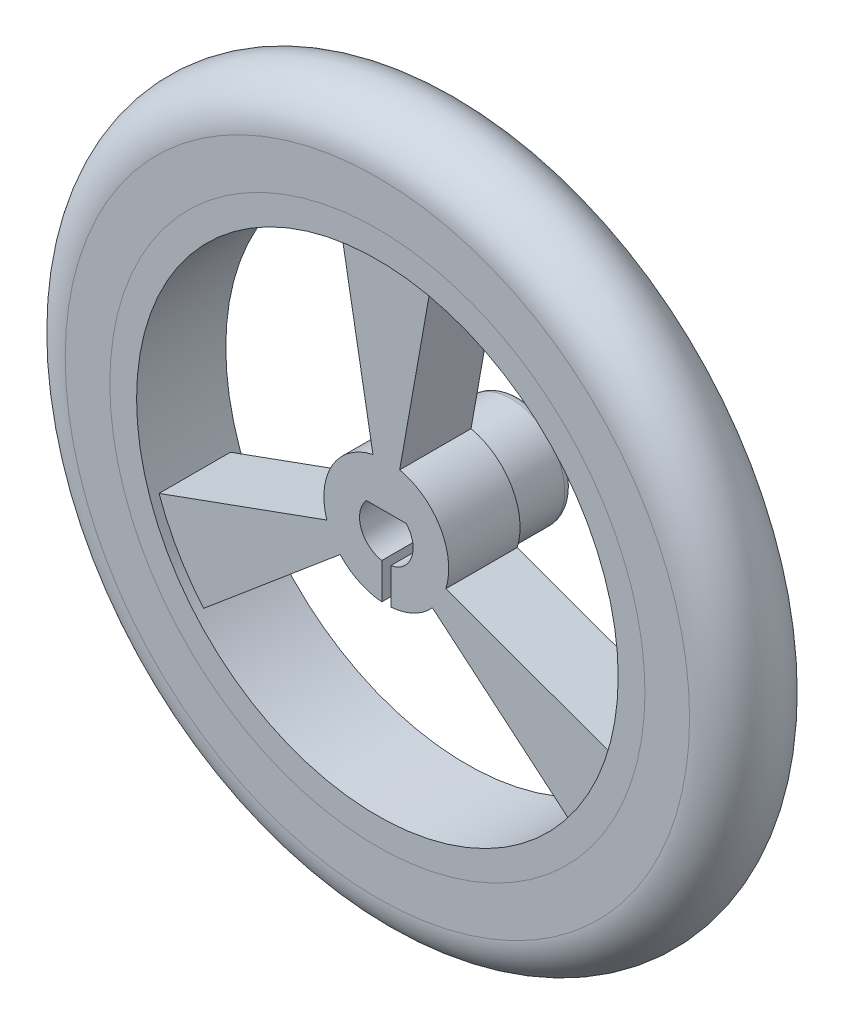
from build123d import *
from build123d.topology import SkipClean

# Parameters (mm, degrees)
ODEBRAT_VYSUNUT_M1_DEPTH = 27.537709019
ODEBRAT_VYSUNUT_M2_DEPTH = 27.537709019


with BuildPart() as part:
    # Skica2 → Rotovat1 (revolve)
    with BuildSketch(Plane(origin=(0, 0, 0), x_dir=(0, 0, -1), z_dir=(1, 0, 0)), mode=Mode.PRIVATE) as rotovat1_sk:
        with BuildLine():
            Line((-2, 13.5), (-2, 0))
            Line((-2, 0), (5.5, 0))
            Line((5.5, 0), (5.5, 2.5))
            ThreePointArc((5.5, 2.5), (5.353553391, 2.853553391), (5, 3))
            Line((5, 3), (2, 3))
            Line((2, 3), (2, 13.5))
            Line((2, 13.5), (2.5, 13.5))
            Line((2.5, 13.5), (2.5, 15))
            Line((2.5, 15), (1, 15))
            Line((1, 15), (1, 18))
            Line((1, 18), (-1, 18))
            Line((-1, 18), (-1, 15))
            Line((-1, 15), (-2.5, 15))
            Line((-2.5, 15), (-2.5, 13.5))
            Line((-2.5, 13.5), (-2, 13.5))
        make_face()
    revolve(rotovat1_sk.sketch.rotate(Axis((0, 0, 36.988949001), (0, 0, -1)), 90), axis=Axis((0, 0, 36.988949001), (0, 0, -1)))

    # Skica3 → Odebrat vysunutím1 (cut, through all)
    with SkipClean():  # the faces are left unmerged after this step: merging them gives an invalid solid
        with BuildSketch(Plane.XY.offset(2)):
            with BuildLine():
                Line((12.739125293, -4.468186071), (3.335679821, -1.059830239))
                ThreePointArc((3.335679821, -1.059830239), (3.031088913, 1.75), (0.75, 3.418698583))
                Line((0.75, 3.418698583), (2.5, 13.266499161))
                ThreePointArc((2.5, 13.266499161), (11.691342951, 6.75), (12.739125293, -4.468186071))
            make_face()
            with BuildLine():
                Line((-2.5, 13.266499161), (-0.75, 3.418698583))
                ThreePointArc((-0.75, 3.418698583), (-3.031088913, 1.75), (-3.335679821, -1.059830239))
                Line((-3.335679821, -1.059830239), (-12.739125293, -4.468186071))
                ThreePointArc((-12.739125293, -4.468186071), (-11.691342951, 6.75), (-2.5, 13.266499161))
            make_face()
            with BuildLine():
                Line((10.239125293, -8.79831309), (2.585679821, -2.358868344))
                ThreePointArc((2.585679821, -2.358868344), (0, -3.5), (-2.585679821, -2.358868344))
                Line((-2.585679821, -2.358868344), (-10.239125293, -8.79831309))
                ThreePointArc((-10.239125293, -8.79831309), (0, -13.5), (10.239125293, -8.79831309))
            make_face()
        extrude(amount=-ODEBRAT_VYSUNUT_M1_DEPTH, mode=Mode.SUBTRACT)

    # Skica4 → Odebrat vysunutím2 (cut, through all)
    with SkipClean():  # the faces are left unmerged after this step: merging them gives an invalid solid
        with BuildSketch(Plane.XY.offset(2)):
            with BuildLine():
                Line((-1.118033989, 1), (1.118033989, 1))
                ThreePointArc((1.118033989, 1), (1.41572039, -0.495717438), (0.25, -1.479019946))
                Line((0.25, -1.479019946), (0.25, -4.832561127))
                Line((0.25, -4.832561127), (-0.25, -4.832561127))
                Line((-0.25, -4.832561127), (-0.25, -1.479019946))
                ThreePointArc((-0.25, -1.479019946), (-1.41572039, -0.495717438), (-1.118033989, 1))
            make_face()
        extrude(amount=-ODEBRAT_VYSUNUT_M2_DEPTH, mode=Mode.SUBTRACT)


with BuildPart() as body_2:
    # Skica5 → Rotovat2 (revolve)
    with BuildSketch(Plane(origin=(0, 0, 0), x_dir=(0, 0, -1), z_dir=(1, 0, 0)), mode=Mode.PRIVATE) as rotovat2_sk:
        with BuildLine():
            Line((-2.5, 15), (-2.5, 17.5))
            ThreePointArc((-2.5, 17.5), (0, 20), (2.5, 17.5))
            Line((2.5, 17.5), (2.5, 15))
            Line((2.5, 15), (1, 15))
            Line((1, 15), (1, 18))
            Line((1, 18), (-1, 18))
            Line((-1, 18), (-1, 15))
            Line((-1, 15), (-2.5, 15))
        make_face()
    revolve(rotovat2_sk.sketch.rotate(Axis((0, 0, 0), (0, 0, -1)), 90), axis=Axis((0, 0, 0), (0, 0, -1)))


solid = Compound([part.part, body_2.part])
